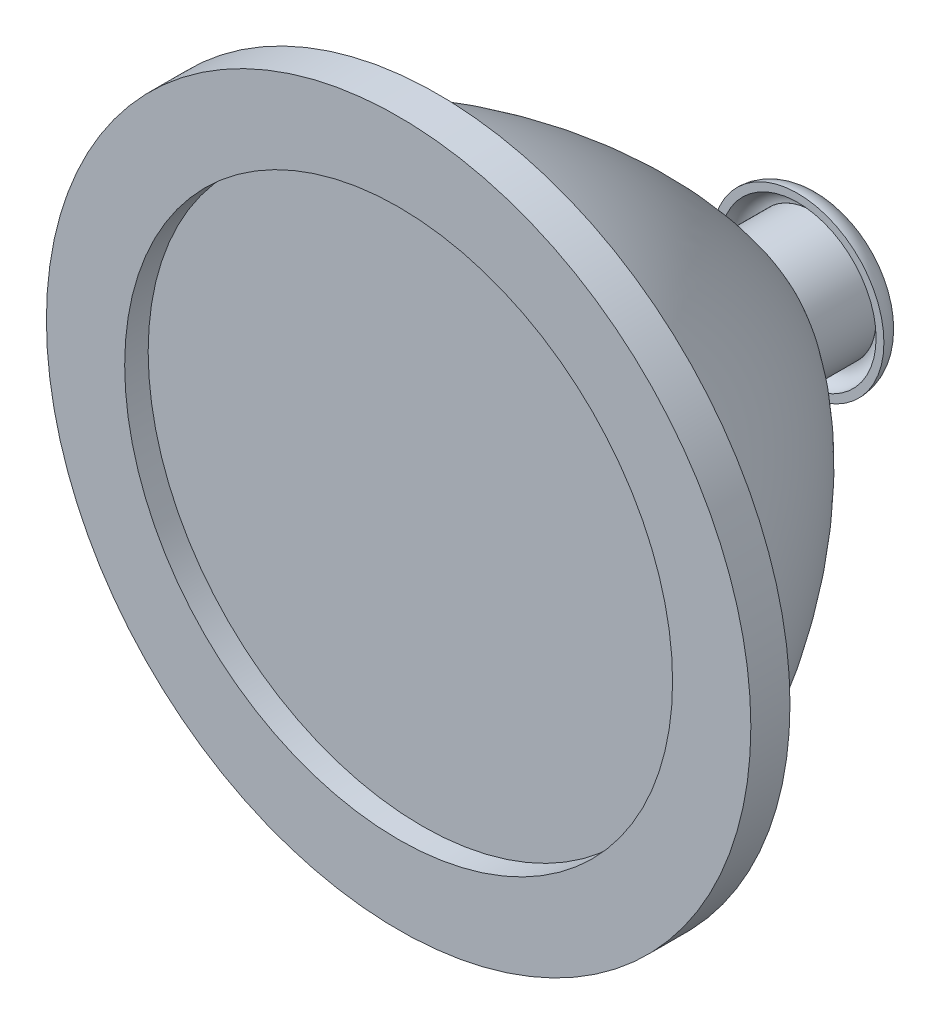
from build123d import *

# Parameters (mm, degrees)
LENSSHELL_T          = -6.35
SKETCH2_R            = 10.16
LENSNECK_DEPTH       = 10.16
BULBHOLE_D           = 13.49248
BULBHOLE_CBORE_D     = 15.24
BULBHOLE_CBORE_DEPTH = 5.08
SKETCH20_R           = 57.15
SKETCH20_R_2         = 44.45
LENSCOVER_DEPTH      = 6.35
SKETCH22_R           = 44.45
LENSSHIELD_DEPTH     = 2.54


with BuildPart() as part:
    # Sketch1 → BaseRevolve (revolve)
    with BuildSketch(Plane(origin=(0, 0, 0), x_dir=(0, 0, -1), z_dir=(1, 0, 0)), mode=Mode.PRIVATE) as baserevolve_sk:
        with BuildLine():
            Line((0, 0), (0, 50.8))
            ThreePointArc((0, 50.8), (28.740706548, 34.655883185), (50.8, 10.16))
            Line((50.8, 10.16), (50.8, 0))
            Line((50.8, 0), (0, 0))
        make_face()
    revolve(baserevolve_sk.sketch.rotate(Axis((0, 0, 43.730744337), (0, 0, -1)), 90), axis=Axis((0, 0, 43.730744337), (0, 0, -1)))

    # LensShell
    lensshell_openings = [part.faces().sort_by_distance(p)[0] for p in [
        (0, 0, 0),
    ]]
    offset(amount=LENSSHELL_T, openings=lensshell_openings, kind=Kind.INTERSECTION)

    # Sketch2 → LensNeck (add)
    with BuildSketch(Plane(origin=(0, 0, -50.8), x_dir=(-1, 0, 0), z_dir=(0, 0, -1))):
        Circle(SKETCH2_R)
    extrude(amount=LENSNECK_DEPTH)

    # BulbHole (through all)
    with Locations(Plane.XY.offset(-44.45)):
        with Locations((0, 0)):
            CounterBoreHole(BULBHOLE_D / 2, BULBHOLE_CBORE_D / 2, BULBHOLE_CBORE_DEPTH)

    # Sketch19 → LensConnector (revolve)
    with BuildSketch(Plane(origin=(0, 0, 0), x_dir=(0, 0, -1), z_dir=(1, 0, 0)), mode=Mode.PRIVATE) as lensconnector_sk:
        with BuildLine():
            ThreePointArc((60.96, 10.16), (60.216051224, 11.956051224), (58.42, 12.7))
            Line((58.42, 12.7), (58.42, 13.97))
            ThreePointArc((58.42, 13.97), (61.114076836, 12.854076836), (62.23, 10.16))
            Line((62.23, 10.16), (60.96, 10.16))
        make_face()
    revolve(lensconnector_sk.sketch.rotate(Axis((0, 0, 0), (0, 0, -1)), 90), axis=Axis((0, 0, 0), (0, 0, -1)))

    # Sketch20 → LensCover (add)
    with BuildSketch(Plane.XY):
        Circle(SKETCH20_R)
        Circle(SKETCH20_R_2, mode=Mode.SUBTRACT)
    extrude(amount=LENSCOVER_DEPTH)

    # Sketch22 → LensShield (add)
    with BuildSketch(Plane.XY):
        Circle(SKETCH22_R)
    extrude(amount=LENSSHIELD_DEPTH)


solid = part.part
